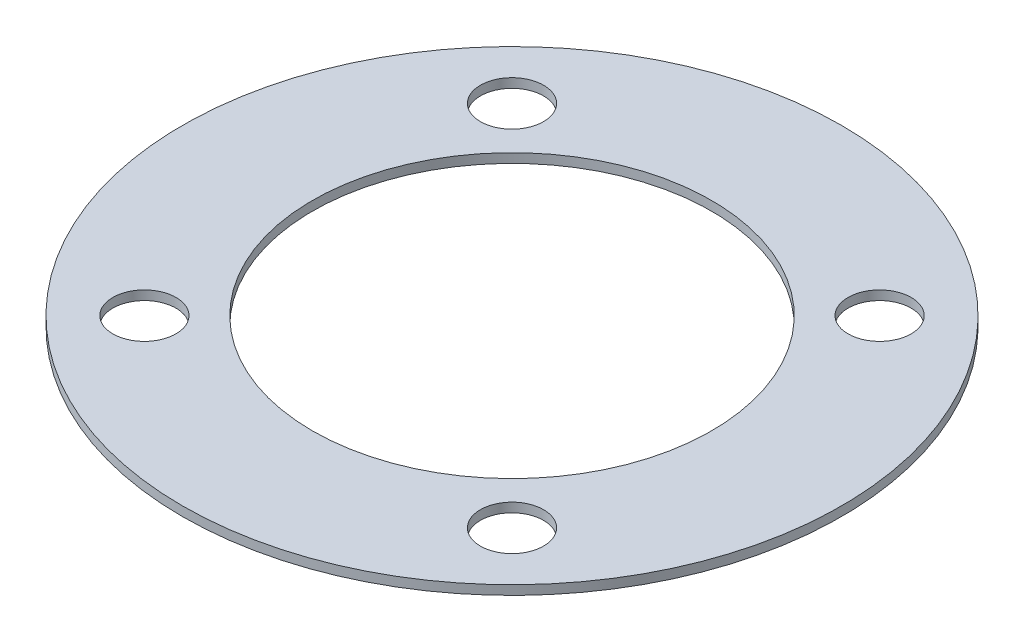
from build123d import *

# Parameters (mm, degrees)
SKETCH_1_R          = 17.75
EXTRUDE_1_DEPTH     = 0.5
SKETCH_2_R          = 10.75
CUT_EXTRUDE_1_DEPTH = 26.107269864
HOLE_WIZARD_M3_1_D  = 3.4


with BuildPart() as part:
    # ｽｹｯﾁ1 → ﾎﾞｽ - 押し出し1 (new body)
    with BuildSketch(Plane(origin=(0, 0, 0), x_dir=(1, 0, 0), z_dir=(0, 1, 0))):
        with Locations(Location((0, 0, 0), (0, 0, 270))):
            Circle(SKETCH_1_R)
    extrude(amount=EXTRUDE_1_DEPTH)

    # ｽｹｯﾁ2 → ｶｯﾄ - 押し出し1 (cut, through all)
    with BuildSketch(Plane(origin=(0, 0.5, 0), x_dir=(1, 0, 0), z_dir=(0, 1, 0))):
        with Locations(Location((0, 0, 0), (0, 0, 270))):
            Circle(SKETCH_2_R)
    extrude(amount=-CUT_EXTRUDE_1_DEPTH, mode=Mode.SUBTRACT)

    # M3 すきま穴1 (through all)
    with Locations(Plane(origin=(0, 0.5, 0), x_dir=(1, 0, 0), z_dir=(0, 1, 0))):
        with Locations((-9.899494937, 9.899494937), (9.899494937, -9.899494937), (-9.899494937, -9.899494937), (9.899494937, 9.899494937)):
            Hole(HOLE_WIZARD_M3_1_D / 2)


solid = part.part
